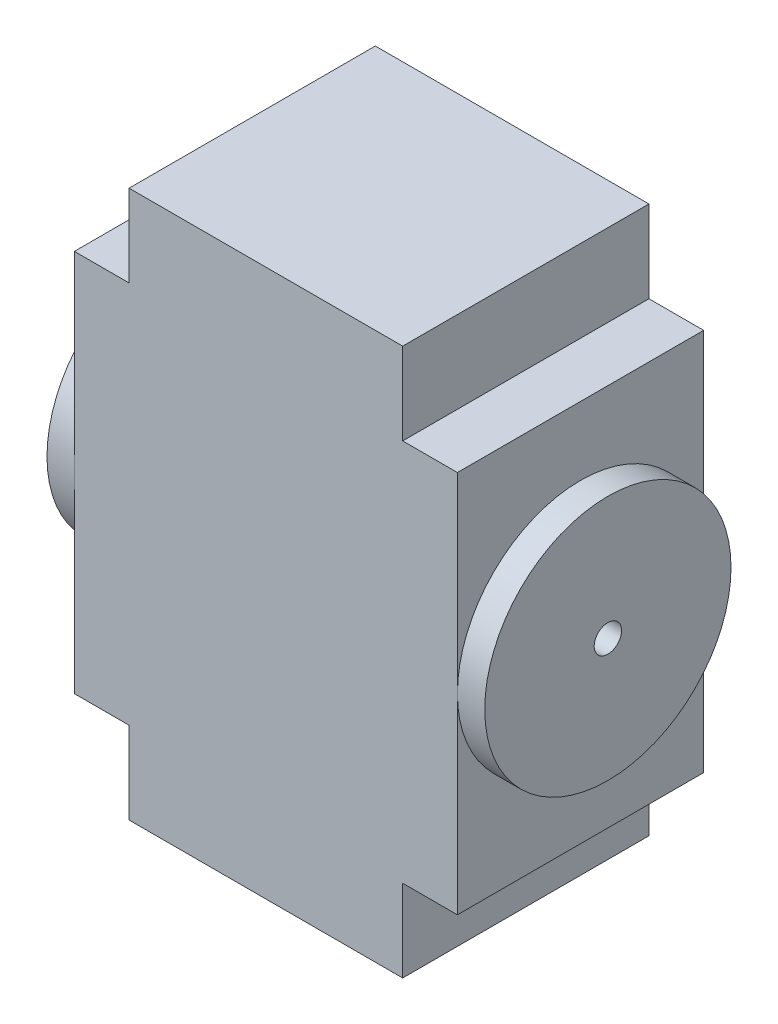
from build123d import *

# Parameters (mm, degrees)
SKETCH_4_W          = 5
SKETCH_4_H          = 10
EXTRUDE_2_DEPTH     = 4.5
SKETCH_5_W          = 4.5
SKETCH_5_H          = 7
EXTRUDE_3_DEPTH     = 1
SKETCH_6_W          = 4.5
SKETCH_6_H          = 7
EXTRUDE_4_DEPTH     = 1
SKETCH_7_R          = 2.25
EXTRUDE_5_DEPTH     = 0.5
SKETCH_8_R          = 0.25
CUT_EXTRUDE_1_DEPTH = 0.5
CUT_EXTRUDE_START   = -0.5
SKETCH_9_R          = 0.25
CUT_EXTRUDE_2_DEPTH = 0.5


with BuildPart() as part:
    # 草图4 → 凸台-拉伸2 (new body)
    with BuildSketch(Plane.XY):
        Rectangle(SKETCH_4_W, SKETCH_4_H)
    extrude(amount=EXTRUDE_2_DEPTH)

    # 草图5 → 凸台-拉伸3 (add)
    with BuildSketch(Plane(origin=(2.5, 0, 0), x_dir=(0, 0, -1), z_dir=(1, 0, 0))):
        with Locations((-2.25, 0)):
            Rectangle(SKETCH_5_W, SKETCH_5_H)
    extrude(amount=EXTRUDE_3_DEPTH)

    # 草图6 → 凸台-拉伸4 (add)
    with BuildSketch(Plane.ZY.offset(2.5)):
        with Locations((2.25, 0)):
            Rectangle(SKETCH_6_W, SKETCH_6_H)
    extrude(amount=EXTRUDE_4_DEPTH)

    # 草图7 → 凸台-拉伸5 (add)
    with BuildSketch(Plane(origin=(3.5, 0, 0), x_dir=(0, 0, -1), z_dir=(1, 0, 0))):
        with Locations((-2.25, 0)):
            Circle(SKETCH_7_R)
    extrude_5 = extrude(amount=EXTRUDE_5_DEPTH)

    # 镜向1: 凸台-拉伸5 across plane
    add(extrude_5.mirror(Plane(origin=(0, 0, 0), x_dir=(0, 0, 1), z_dir=(1, 0, 0))))

    # 草图8 → 切除-拉伸1 (cut)
    with BuildSketch(Plane(origin=(4, 0, 0), x_dir=(0, 0, -1), z_dir=(1, 0, 0))):
        with Locations((-2.25, 0)):
            Circle(SKETCH_8_R)
    extrude(amount=-CUT_EXTRUDE_1_DEPTH, mode=Mode.SUBTRACT)

    # 草图9 → 切除-拉伸2 (cut)
    with BuildSketch(Plane.ZY.offset(4).offset(CUT_EXTRUDE_START)):
        with Locations(Location((2.25, 0, 0), (0, 0, 180))):
            Circle(SKETCH_9_R)
    extrude(amount=CUT_EXTRUDE_2_DEPTH, mode=Mode.SUBTRACT)


solid = part.part
